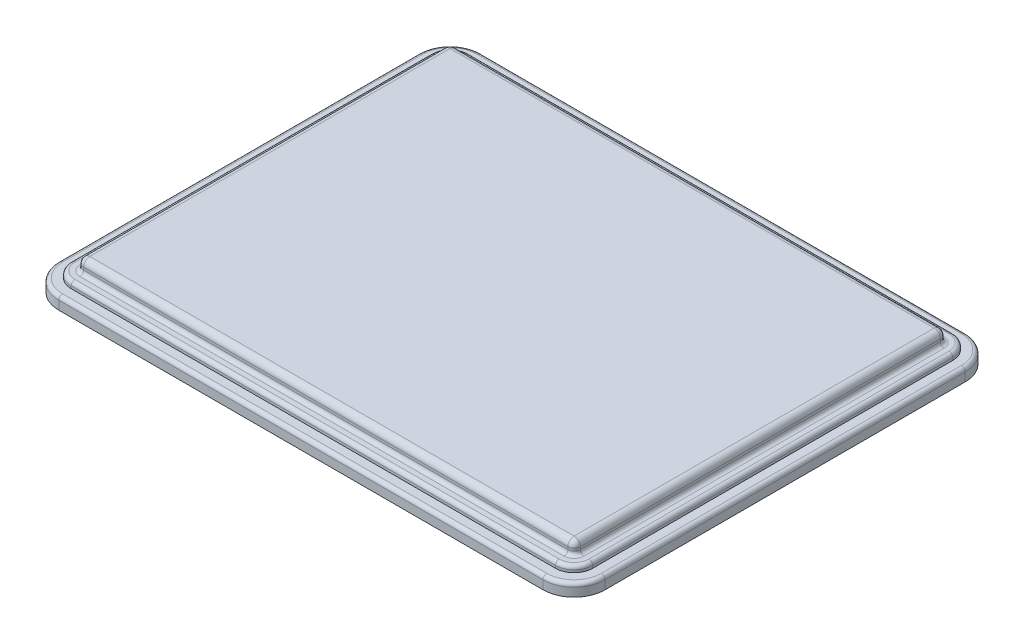
from build123d import *

# Parameters (mm, degrees)
SKETCH1_W           = 400
SKETCH1_H           = 300
BOSS_EXTRUDE1_DEPTH = 10
FILLET1_R           = 5
FILLET2_R           = 5
BOSS_EXTRUDE2_DEPTH = 5
BOSS_EXTRUDE5_DEPTH = 10
FILLET3_R           = 3
FILLET4_R           = 3


with BuildPart() as part:
    # Sketch1 → Boss-Extrude1 (new body)
    with BuildSketch(Plane(origin=(0, 0, 0), x_dir=(1, 0, 0), z_dir=(0, 1, 0))):
        Rectangle(SKETCH1_W, SKETCH1_H)
    extrude(amount=BOSS_EXTRUDE1_DEPTH)

    # Fillet1
    fillet1_edges = [part.edges().sort_by_distance(p)[0] for p in [
        (-200, 5, -150),
        (200, 5, -150),
        (200, 5, 150),
        (-200, 5, 150),
    ]]
    fillet(fillet1_edges, radius=FILLET1_R)

    # Fillet2
    fillet2_edges = [part.edges().sort_by_distance(p)[0] for p in [
        (-200, 10, 0),
        (0, 10, -150),
        (0, 10, 150),
        (200, 10, 0),
        (198.535533906, 10, 148.535533906),
        (198.535533906, 10, -148.535533906),
        (-198.535533906, 10, 148.535533906),
        (-198.535533906, 10, -148.535533906),
    ]]
    fillet(fillet2_edges, radius=FILLET2_R)

    # Sketch2 → Boss-Extrude2 (add)
    with BuildSketch(Plane.XZ):
        with BuildLine():
            Line((195, 160), (-195, 160))
            ThreePointArc((-195, 160), (-205.606601718, 155.606601718), (-210, 145))
            Line((-210, 145), (-210, -145))
            ThreePointArc((-210, -145), (-205.606601718, -155.606601718), (-195, -160))
            Line((-195, -160), (195, -160))
            ThreePointArc((195, -160), (205.606601718, -155.606601718), (210, -145))
            Line((210, -145), (210, 145))
            ThreePointArc((210, 145), (205.606601718, 155.606601718), (195, 160))
        make_face()
    extrude(amount=BOSS_EXTRUDE2_DEPTH)

    # Fillet3
    fillet3_edges = [part.edges().sort_by_distance(p)[0] for p in [
        (-200, 0, 0),
        (0, 0, -150),
        (200, 0, 0),
        (0, 0, 150),
        (198.535533906, 0, 148.535533906),
        (198.535533906, 0, -148.535533906),
        (-198.535533906, 0, 148.535533906),
        (-198.535533906, 0, -148.535533906),
        (205.606601718, 0, 155.606601718),
        (0, 0, 160),
        (-205.606601718, 0, 155.606601718),
        (-210, 0, 0),
        (-205.606601718, 0, -155.606601718),
        (0, 0, -160),
        (205.606601718, 0, -155.606601718),
        (210, 0, 0),
    ]]
    fillet(fillet3_edges, radius=FILLET3_R)


with BuildPart() as body_2:
    # Sketch3 → Boss-Extrude5 (new body)
    with BuildSketch(Plane.XZ.offset(5)):
        with BuildLine():
            Line((195, 170), (-195, 170))
            ThreePointArc((-195, 170), (-212.67766953, 162.67766953), (-220, 145))
            Line((-220, 145), (-220, -145))
            ThreePointArc((-220, -145), (-212.67766953, -162.67766953), (-195, -170))
            Line((-195, -170), (195, -170))
            ThreePointArc((195, -170), (212.67766953, -162.67766953), (220, -145))
            Line((220, -145), (220, 145))
            ThreePointArc((220, 145), (212.67766953, 162.67766953), (195, 170))
        make_face()
    extrude(amount=BOSS_EXTRUDE5_DEPTH)

    # Fillet4
    fillet4_edges = [body_2.edges().sort_by_distance(p)[0] for p in [
        (0, -5, -170),
        (-212.67766953, -5, -162.67766953),
        (-220, -5, 0),
        (-212.67766953, -5, 162.67766953),
        (0, -5, 170),
        (212.67766953, -5, 162.67766953),
        (220, -5, 0),
        (212.67766953, -5, -162.67766953),
    ]]
    fillet(fillet4_edges, radius=FILLET4_R)


solid = Compound([part.part, body_2.part])
